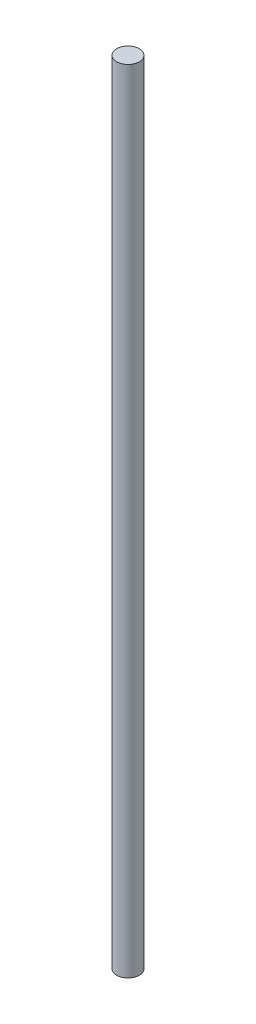
from build123d import *

# Parameters (mm, degrees)
SKETCH1_R           = 4
BOSS_EXTRUDE1_DEPTH = 280


with BuildPart() as part:
    # Sketch1 → Boss-Extrude1 (new body)
    with BuildSketch(Plane(origin=(0, 0, 0), x_dir=(1, 0, 0), z_dir=(0, 1, 0))):
        with Locations(Location((0, 0, 0), (0, 0, 270))):
            Circle(SKETCH1_R)
    extrude(amount=BOSS_EXTRUDE1_DEPTH)


solid = part.part
